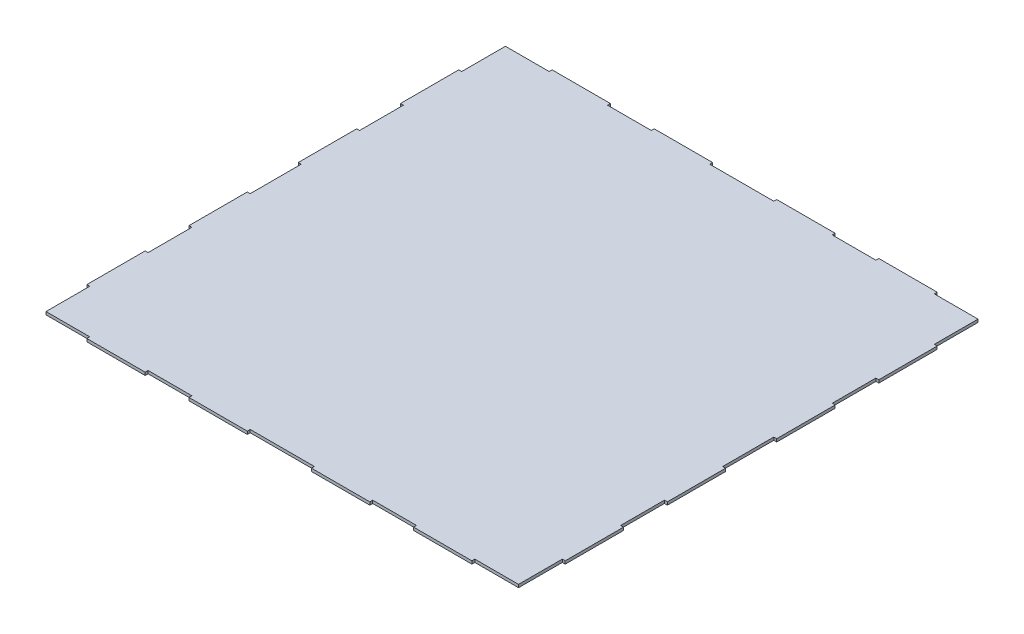
from build123d import *

# Parameters (mm, degrees)
SKETCH1_R               = 4.25
BOSS_EXTRUDE1_DEPTH     = 2
CUT_EXTRUDE1_DEPTH      = 253.36927309
CUT_EXTRUDE1_DEPTH_BACK = 253.36927309
SKETCH2_W               = 130
SKETCH2_H               = 36
SKETCH5_W               = 2
SKETCH5_H               = 40
SKETCH5_W_2             = 40
SKETCH5_H_2             = 2
BOSS_EXTRUDE2_DEPTH     = 2


with BuildPart() as part:
    # Sketch1 → Boss-Extrude1 (new body)
    with BuildSketch(Plane(origin=(0, 0, 0), x_dir=(1, 0, 0), z_dir=(0, 1, 0))):
        Polygon((64, -157.5), (162, -157.5), (162, 157.5), (-162, 157.5), (-162, -157.5), (-66, -157.5), (-66, -193.5), (64, -193.5), align=None)
        with Locations(Location((-51, -175.5, 0), (0, 0, 270))):
            Circle(SKETCH1_R, mode=Mode.SUBTRACT)
        with Locations(Location((49, -175.5, 0), (0, 0, 270))):
            Circle(SKETCH1_R, mode=Mode.SUBTRACT)
    extrude(amount=BOSS_EXTRUDE1_DEPTH)

    # Sketch2 → Cut-Extrude1 (cut, two sides: drawn at the far end of the back side and taken through both)
    with BuildSketch(Plane(origin=(0, 2, 0), x_dir=(1, 0, 0), z_dir=(0, 1, 0)).offset(-CUT_EXTRUDE1_DEPTH_BACK)):
        with Locations((-1, -175.5)):
            Rectangle(SKETCH2_W, SKETCH2_H)
    extrude(amount=CUT_EXTRUDE1_DEPTH + CUT_EXTRUDE1_DEPTH_BACK, mode=Mode.SUBTRACT)

    # Sketch5 → Boss-Extrude2 (add)
    with BuildSketch(Plane.XZ):
        with Locations((-163, 107.5)):
            Rectangle(SKETCH5_W, SKETCH5_H)
        with Locations((-163, 37.5)):
            Rectangle(SKETCH5_W, SKETCH5_H)
        with Locations((-112, 158.5)):
            Rectangle(SKETCH5_W_2, SKETCH5_H_2)
        with Locations((-42, 158.5)):
            Rectangle(SKETCH5_W_2, SKETCH5_H_2)
        with Locations((-163, -107.5)):
            Rectangle(SKETCH5_W, SKETCH5_H)
        with Locations((-163, -37.5)):
            Rectangle(SKETCH5_W, SKETCH5_H)
        with Locations((-112, -158.5)):
            Rectangle(SKETCH5_W_2, SKETCH5_H_2)
        with Locations((-42, -158.5)):
            Rectangle(SKETCH5_W_2, SKETCH5_H_2)
        with Locations((42, -158.5)):
            Rectangle(SKETCH5_W_2, SKETCH5_H_2)
        with Locations((112, -158.5)):
            Rectangle(SKETCH5_W_2, SKETCH5_H_2)
        with Locations((163, -37.5)):
            Rectangle(SKETCH5_W, SKETCH5_H)
        with Locations((163, -107.5)):
            Rectangle(SKETCH5_W, SKETCH5_H)
        with Locations((42, 158.5)):
            Rectangle(SKETCH5_W_2, SKETCH5_H_2)
        with Locations((112, 158.5)):
            Rectangle(SKETCH5_W_2, SKETCH5_H_2)
        with Locations((163, 37.5)):
            Rectangle(SKETCH5_W, SKETCH5_H)
        with Locations((163, 107.5)):
            Rectangle(SKETCH5_W, SKETCH5_H)
    extrude(amount=-BOSS_EXTRUDE2_DEPTH)


solid = part.part
